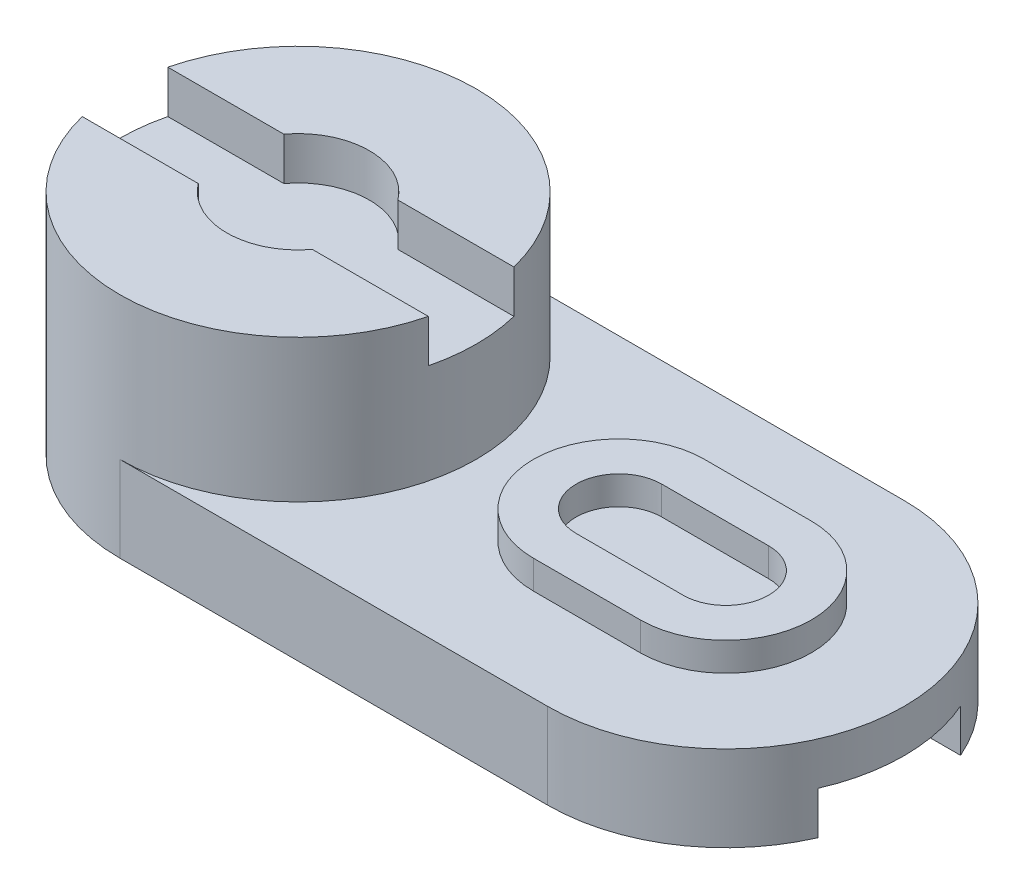
from build123d import *

# Parameters (mm, degrees)
BOSS_EXTRUDE1_DEPTH = 12
SKETCH2_R           = 25
BOSS_EXTRUDE2_DEPTH = 20
BOSS_EXTRUDE3_DEPTH = 4
SKETCH4_W           = 55
SKETCH4_H           = 12
CUT_EXTRUDE1_DEPTH  = 6
SKETCH5_R           = 10
CUT_EXTRUDE2_DEPTH  = 17
SKETCH6_W           = 125
SKETCH6_H           = 20
CUT_EXTRUDE3_DEPTH  = 6


with BuildPart() as part:
    # Sketch1 → Boss-Extrude1 (new body)
    with BuildSketch(Plane(origin=(0, 0, 0), x_dir=(1, 0, 0), z_dir=(0, 1, 0))):
        with BuildLine():
            Line((-30, 25), (30, 25))
            ThreePointArc((30, 25), (55, 0), (30, -25))
            Line((30, -25), (-30, -25))
            ThreePointArc((-30, -25), (-55, 0), (-30, 25))
        make_face()
    extrude(amount=BOSS_EXTRUDE1_DEPTH)

    # Sketch2 → Boss-Extrude2 (add)
    with BuildSketch(Plane(origin=(0, 12, 0), x_dir=(1, 0, 0), z_dir=(0, 1, 0))):
        with Locations(Location((-30, 0, 0), (0, 0, 270))):
            Circle(SKETCH2_R)
    extrude(amount=BOSS_EXTRUDE2_DEPTH)

    # Sketch3 → Boss-Extrude3 (add)
    with BuildSketch(Plane(origin=(0, 12, 0), x_dir=(1, 0, 0), z_dir=(0, 1, 0))):
        with BuildLine():
            Line((30, -12), (15, -12))
            ThreePointArc((15, -12), (3, 0), (15, 12))
            Line((15, 12), (30, 12))
            ThreePointArc((30, 12), (42, 0), (30, -12))
        make_face()
        with BuildLine():
            Line((30, -6), (15, -6))
            ThreePointArc((15, -6), (9, 0), (15, 6))
            Line((15, 6), (30, 6))
            ThreePointArc((30, 6), (36, 0), (30, -6))
        make_face(mode=Mode.SUBTRACT)
    extrude(amount=BOSS_EXTRUDE3_DEPTH)

    # Sketch4 → Cut-Extrude1 (cut)
    with BuildSketch(Plane(origin=(0, 32, 0), x_dir=(1, 0, 0), z_dir=(0, 1, 0))):
        with Locations((-30, 0)):
            Rectangle(SKETCH4_W, SKETCH4_H)
    extrude(amount=-CUT_EXTRUDE1_DEPTH, mode=Mode.SUBTRACT)

    # Sketch5 → Cut-Extrude2 (cut)
    with BuildSketch(Plane(origin=(0, 26, 0), x_dir=(1, 0, 0), z_dir=(0, 1, 0))):
        with Locations((-30, 0)):
            Circle(SKETCH5_R)
    extrude(amount=CUT_EXTRUDE2_DEPTH, mode=Mode.SUBTRACT)

    # Sketch6 → Cut-Extrude3 (cut)
    with BuildSketch(Plane.XZ):
        Rectangle(SKETCH6_W, SKETCH6_H)
    extrude(amount=-CUT_EXTRUDE3_DEPTH, mode=Mode.SUBTRACT)


solid = part.part
